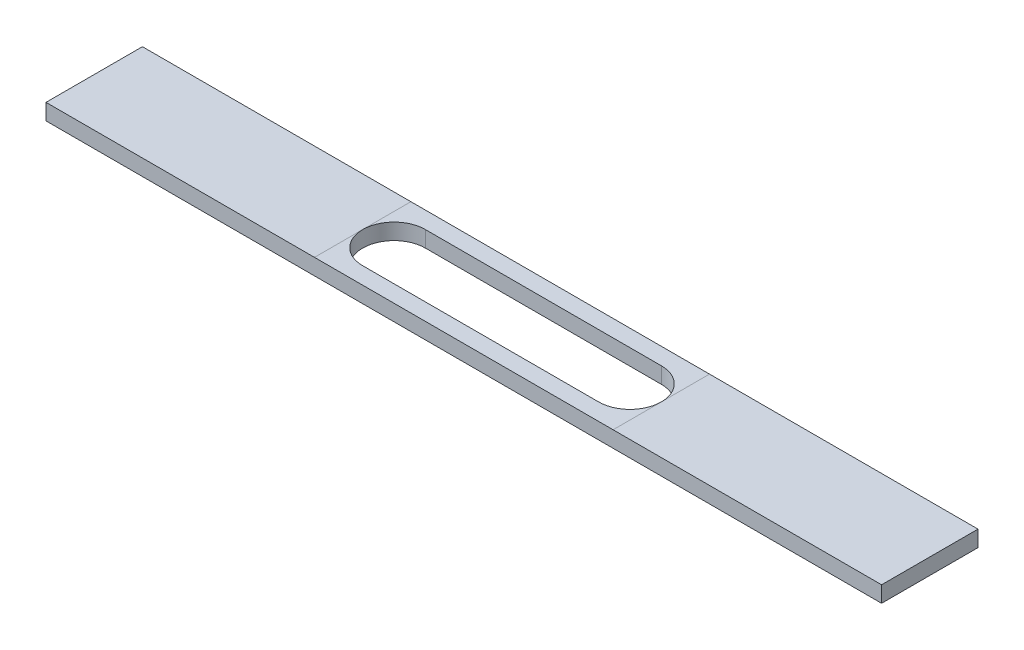
from build123d import *

# Parameters (mm, degrees)
SKETCH1_W           = 165.1
SKETCH1_H           = 19.05
BOSS_EXTRUDE1_DEPTH = 3.175
SLOT_DEPTH          = 84.158335421


with BuildPart() as part:
    # Sketch1 → Boss-Extrude1 (new body)
    with BuildSketch(Plane(origin=(0, 0, 0), x_dir=(1, 0, 0), z_dir=(0, 1, 0))):
        Rectangle(SKETCH1_W, SKETCH1_H)
    extrude(amount=BOSS_EXTRUDE1_DEPTH)

    # Sketch5 → Slot (cut, through all)
    with BuildSketch(Plane(origin=(0, 3.175, 0), x_dir=(1, 0, 0), z_dir=(0, 1, 0))):
        with BuildLine():
            Line((-23.31, 6.19), (23.31, 6.19))
            ThreePointArc((23.31, 6.19), (29.5, 0), (23.31, -6.19))
            Line((23.31, -6.19), (-23.31, -6.19))
            ThreePointArc((-23.31, -6.19), (-29.5, 0), (-23.31, 6.19))
        make_face()
    extrude(amount=-SLOT_DEPTH, mode=Mode.SUBTRACT)


solid = part.part
